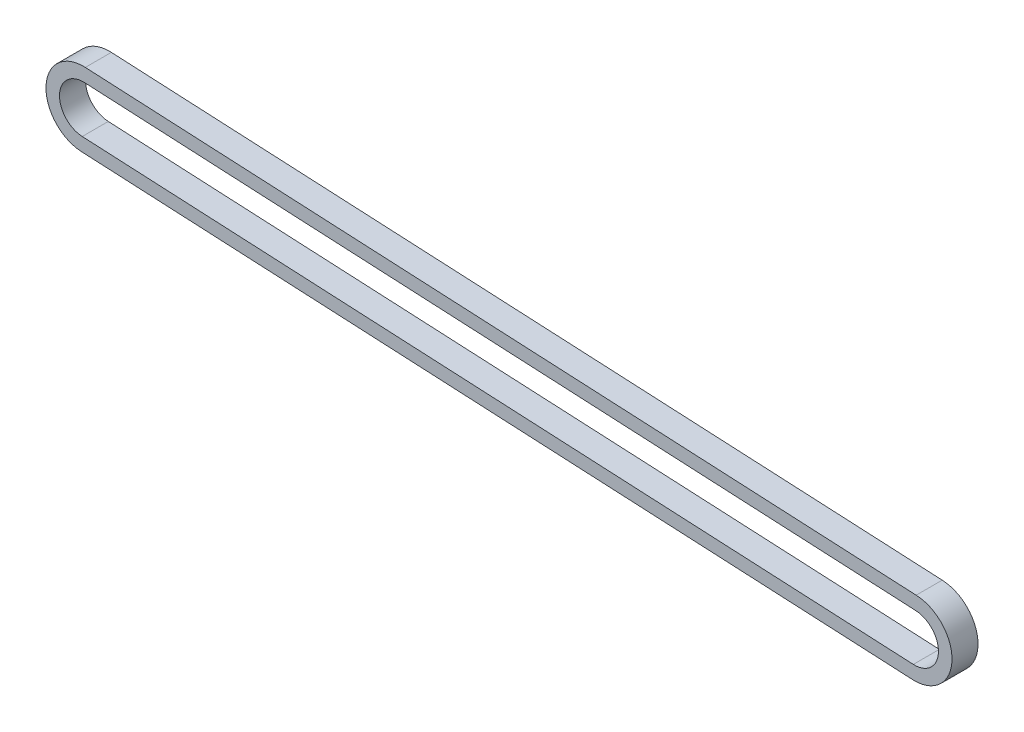
from build123d import *

# Parameters (mm, degrees)
BOSS_EXTRUDE1_DEPTH = 3.175


with BuildPart() as part:
    # Sketch1 → Boss-Extrude1 (new body)
    with BuildSketch(Plane.XY):
        with BuildLine():
            Line((0.201062713, 4.567576796), (-101.117110611, 9.646266927))
            ThreePointArc((-101.117110611, 9.646266927), (-105.912267023, 5.308887479), (-101.57488557, 0.513732882))
            Line((-101.57488557, 0.513732882), (-0.22888557, -4.566267118))
            ThreePointArc((-0.22888557, -4.566267118), (4.566943145, -0.214975139), (0.201062713, 4.567576796))
        make_face()
        with BuildLine():
            Line((-101.492232447, 2.162662674), (-0.146232447, -2.917337326))
            ThreePointArc((-0.146232447, -2.917337326), (2.91787344, -0.135113247), (0.123992085, 2.918367174))
            Line((0.123992085, 2.918367174), (-101.199765113, 7.997337203))
            ThreePointArc((-101.199765113, 7.997337203), (-104.263337264, 5.226233667), (-101.492232447, 2.162662674))
        make_face(mode=Mode.SUBTRACT)
    extrude(amount=BOSS_EXTRUDE1_DEPTH)


solid = part.part
